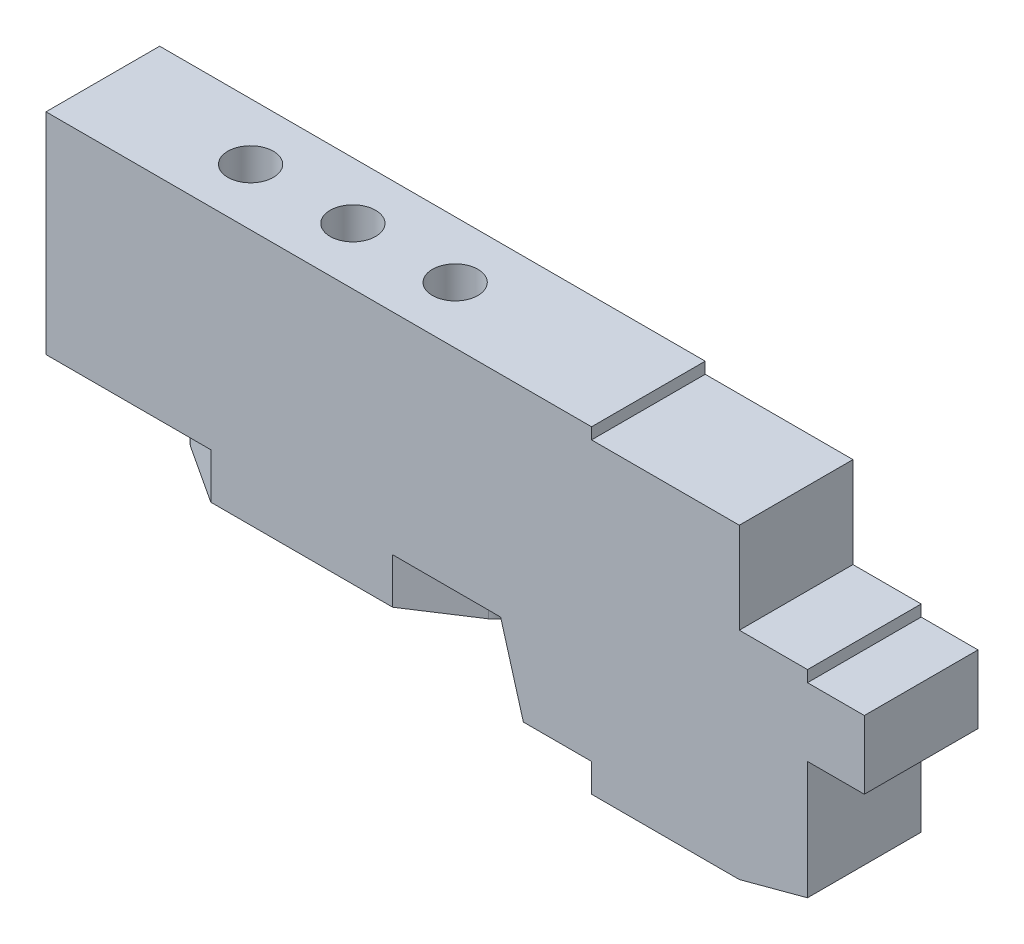
from build123d import *

# Parameters (mm, degrees)
EXTRUDE_1_DEPTH     = 10
SKETCH_2_R          = 2
EXTRUDE_2_DEPTH     = 4
SKETCH_3_R          = 2
CUT_EXTRUDE_1_DEPTH = 10


with BuildPart() as part:
    # 草图1 → 凸台-拉伸1 (new body)
    with BuildSketch(Plane.XY):
        Polygon((18, -16.25), (16, -9.25), (-24, -9.25), (-24, 9.25), (24, 9.25), (24, 8.25), (37, 8.25), (37, 0.25), (43, 0.25), (43, -0.75), (48, -0.75), (48, -6.75), (43, -6.75), (43, -17.142304845), (37, -18.75), (24, -18.75), (24, -16.25), align=None)
    extrude(amount=EXTRUDE_1_DEPTH)

    # 草图2 → 凸台-拉伸2 (add)
    with BuildSketch(Plane.XZ.offset(9.25)):
        with BuildLine():
            Line((-14.593356715, 6.674685372), (-9.5, 10))
            Line((-9.5, 10), (6.5, 10))
            Line((6.5, 10), (11.593356715, 6.674685372))
            ThreePointArc((11.593356715, 6.674685372), (12.5, 5), (11.593356715, 3.325314628))
            Line((11.593356715, 3.325314628), (6.5, 0))
            Line((6.5, 0), (-9.5, 0))
            Line((-9.5, 0), (-14.593356715, 3.325314628))
            ThreePointArc((-14.593356715, 3.325314628), (-15.5, 5), (-14.593356715, 6.674685372))
        make_face()
        with Locations((-6.75, 5)):
            Circle(SKETCH_2_R, mode=Mode.SUBTRACT)
        with Locations((3.75, 5)):
            Circle(SKETCH_2_R, mode=Mode.SUBTRACT)
    extrude(amount=EXTRUDE_2_DEPTH)

    # 草图3 → 切除-拉伸1 (cut)
    with BuildSketch(Plane(origin=(0, 9.25, 0), x_dir=(1, 0, 0), z_dir=(0, 1, 0))):
        with Locations(Location((-2, -5, 0), (0, 0, 180))):
            Circle(SKETCH_3_R)
        with Locations(Location((-11, -5, 0), (0, 0, 180))):
            Circle(SKETCH_3_R)
        with Locations(Location((7, -5, 0), (0, 0, 180))):
            Circle(SKETCH_3_R)
    extrude(amount=-CUT_EXTRUDE_1_DEPTH, mode=Mode.SUBTRACT)


solid = part.part
